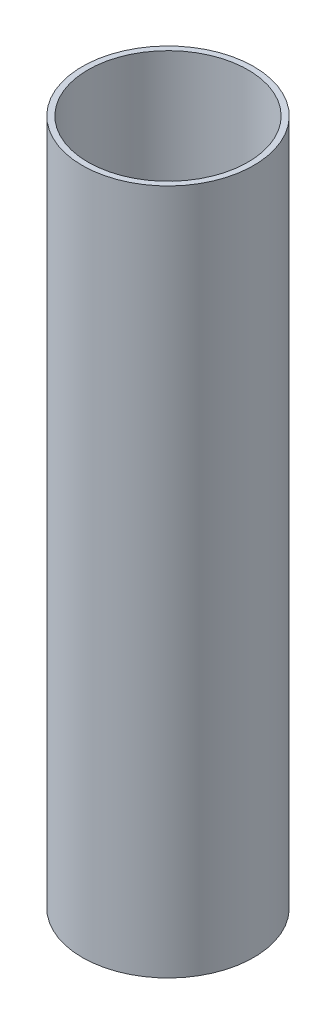
from build123d import *

# Parameters (mm, degrees)
SKETCH_1_R      = 60
EXTRUDE_1_DEPTH = 240
SHELL_3_T       = -4


with BuildPart() as part:
    # 草图1 → 凸台-拉伸1 (new, symmetric)
    with BuildSketch(Plane(origin=(0, 0, 0), x_dir=(1, 0, 0), z_dir=(0, 1, 0))):
        with Locations(Location((0, 0, 0), (0, 0, 270))):
            Circle(SKETCH_1_R)
    extrude(amount=EXTRUDE_1_DEPTH, both=True)

    # 抽壳3
    shell_3_openings = [part.faces().sort_by_distance(p)[0] for p in [
        (0, 240, 0),
    ]]
    offset(amount=SHELL_3_T, openings=shell_3_openings, kind=Kind.INTERSECTION)


solid = part.part
